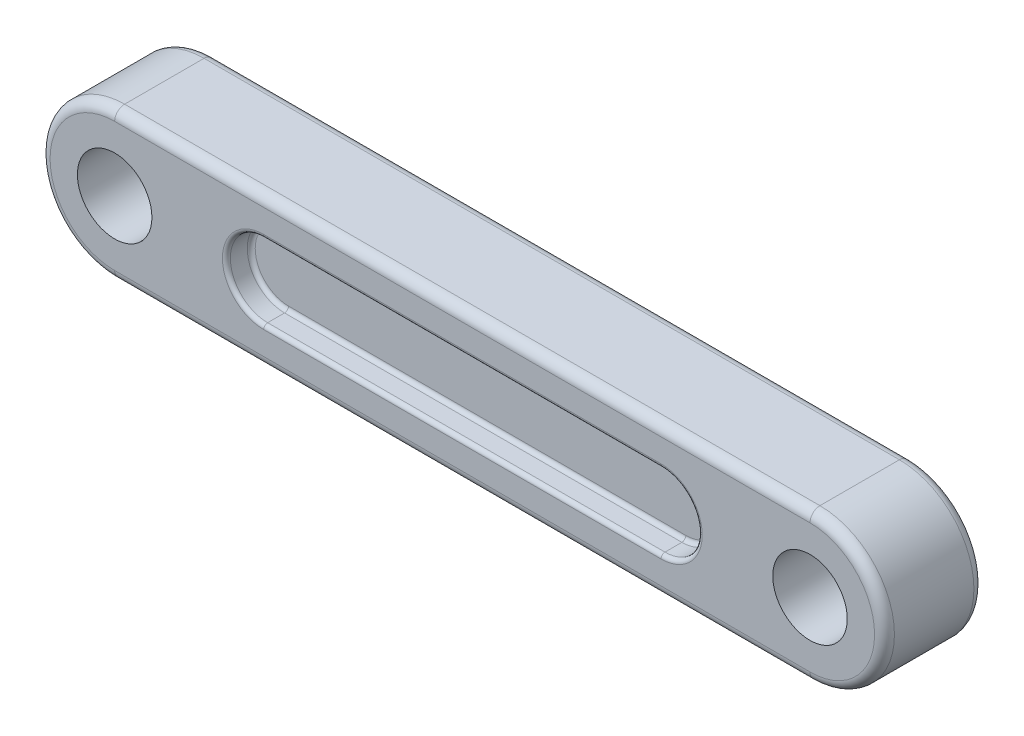
from build123d import *

# Parameters (mm, degrees)
SKETCH1_R           = 4.7625
BOSS_EXTRUDE1_DEPTH = 12.7
FILLET1_R           = 1.27
CUT_EXTRUDE1_DEPTH  = 3.175
CUT_EXTRUDE2_START  = -3.175
CUT_EXTRUDE2_DEPTH  = 3.175
FILLET3_R           = 0.508


with BuildPart() as part:
    # Sketch1 → Boss-Extrude1 (new body)
    with BuildSketch(Plane.XY):
        with BuildLine():
            Line((-44.45, 9.525), (44.45, 9.525))
            ThreePointArc((44.45, 9.525), (53.975, 0), (44.45, -9.525))
            Line((44.45, -9.525), (-44.45, -9.525))
            ThreePointArc((-44.45, -9.525), (-53.975, 0), (-44.45, 9.525))
        make_face()
        with Locations((-44.45, 0)):
            Circle(SKETCH1_R, mode=Mode.SUBTRACT)
        with Locations((44.45, 0)):
            Circle(SKETCH1_R, mode=Mode.SUBTRACT)
    extrude(amount=BOSS_EXTRUDE1_DEPTH)

    # Fillet1
    fillet1_edges = [part.edges().sort_by_distance(p)[0] for p in [
        (53.975, 0, 12.7),
        (0, 9.525, 12.7),
        (-53.975, 0, 12.7),
        (0, 9.525, 0),
        (53.975, 0, 0),
        (0, -9.525, 0),
        (-53.975, 0, 0),
        (0, -9.525, 12.7),
    ]]
    fillet(fillet1_edges, radius=FILLET1_R)

    # Sketch2 → Cut-Extrude1 (cut)
    with BuildSketch(Plane.XY.offset(12.7)):
        with BuildLine():
            Line((-25.4, 4.7625), (25.4, 4.7625))
            ThreePointArc((25.4, 4.7625), (30.1625, 0), (25.4, -4.7625))
            Line((25.4, -4.7625), (-25.4, -4.7625))
            ThreePointArc((-25.4, -4.7625), (-30.1625, 0), (-25.4, 4.7625))
        make_face()
    extrude(amount=-CUT_EXTRUDE1_DEPTH, mode=Mode.SUBTRACT)

    # Sketch3 → Cut-Extrude2 (cut)
    with BuildSketch(Plane(origin=(0, 0, 0), x_dir=(-1, 0, 0), z_dir=(0, 0, -1)).offset(CUT_EXTRUDE2_START)):
        with BuildLine():
            Line((25.4, -4.7625), (-25.4, -4.7625))
            ThreePointArc((-25.4, -4.7625), (-30.1625, 0), (-25.4, 4.7625))
            Line((-25.4, 4.7625), (25.4, 4.7625))
            ThreePointArc((25.4, 4.7625), (30.1625, 0), (25.4, -4.7625))
        make_face()
    extrude(amount=CUT_EXTRUDE2_DEPTH, mode=Mode.SUBTRACT)

    # Fillet3
    fillet3_edges = [part.edges().sort_by_distance(p)[0] for p in [
        (-30.1625, 0, 9.525),
        (0, 4.7625, 9.525),
        (30.1625, 0, 9.525),
        (0, -4.7625, 9.525),
        (-30.1625, 0, 12.7),
        (0, -4.7625, 12.7),
        (30.1625, 0, 12.7),
        (0, 4.7625, 12.7),
        (-30.1625, 0, 3.175),
        (0, -4.7625, 3.175),
        (30.1625, 0, 3.175),
        (0, 4.7625, 3.175),
        (-30.1625, 0, 0),
        (0, 4.7625, 0),
        (30.1625, 0, 0),
        (0, -4.7625, 0),
    ]]
    fillet(fillet3_edges, radius=FILLET3_R)


solid = part.part
